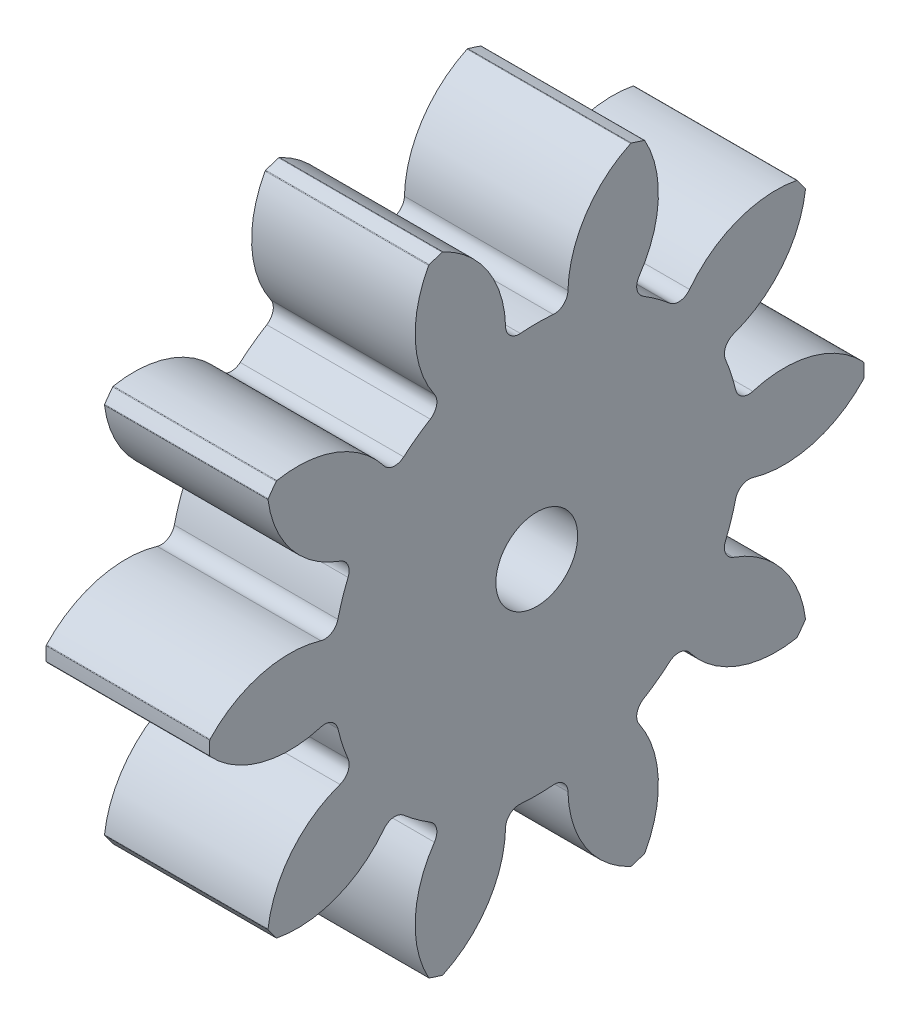
from build123d import *

# Parameters (mm, degrees)
BASPROSKE_W                = 12
BASPROSKE_H                = 24
TOOTHCUT_DEPTH             = 37
BREAKS_R                   = 0.08
ROOTFILLETS_R              = 1.001
TEETHCUTS_COUNT            = 10
TEETHCUTS_ANGLE            = 324
BREAKS_OF_TEETHCUTS_R      = 0.08
ROOTFILLETS_OF_TEETHCUTS_R = 1.001
BORSKE_R                   = 3
BORE_DEPTH                 = 50.0000508


with BuildPart() as part:
    # BasProSke → Base-Revolve (revolve)
    with BuildSketch(Plane(origin=(0, 0, 0), x_dir=(1, 0, 0), z_dir=(0, 1, 0))):
        with Locations((6, 12)):
            Rectangle(BASPROSKE_W, BASPROSKE_H)
    revolve(axis=Axis((-10, 0, 0), (1, 0, 0)))

    # TooCutSke → ToothCut (cut, through all)
    with BuildSketch(Plane(origin=(0, 0, 0), x_dir=(0, 0, -1), z_dir=(1, 0, 0))):
        with BuildLine():
            ThreePointArc((2.33803632, 14.815653451), (0, 14.999), (-2.33803632, 14.815653451))
            ThreePointArc((-2.33803632, 14.815653451), (-3.315013319, 19.654913653), (-6.946609122, 22.999227528))
            ThreePointArc((-6.946609122, 22.999227528), (0, 24.0254), (6.946609122, 22.999227528))
            ThreePointArc((6.946609122, 22.999227528), (3.315013319, 19.654913653), (2.33803632, 14.815653451))
        make_face()
    toothcut = extrude(amount=TOOTHCUT_DEPTH, mode=Mode.SUBTRACT)

    # Breaks
    breaks_edges = [part.edges().sort_by_distance(p)[0] for p in [
        (6, 22.983169708, -6.911867344),
        (6, 22.983169708, 6.911867344),
    ]]
    fillet(breaks_edges, radius=BREAKS_R)

    # RootFillets
    rootfillets_edges = [part.edges().sort_by_distance(p)[0] for p in [
        (6, 14.815653451, -2.33803632),
        (6, 14.815653451, 2.33803632),
    ]]
    fillet(rootfillets_edges, radius=ROOTFILLETS_R)

    # TeethCuts: ToothCut ×10 about axis
    teethcuts_axis = Axis((-10, 0, 0), (1, 0, 0))
    for i in range(1, TEETHCUTS_COUNT):
        add(toothcut.rotate(teethcuts_axis, i * TEETHCUTS_ANGLE / (TEETHCUTS_COUNT - 1)), mode=Mode.SUBTRACT)

    # Breaks of TeethCuts
    breaks_of_teethcuts_edges = [part.edges().sort_by_distance(p)[0] for p in [
        (6, 22.656468569, 7.917350061),
        (6, 14.531081187, 19.10098635),
        (6, 13.675766502, 19.722408843),
        (6, 0.528613547, 23.994177788),
        (6, -0.528613547, 23.994177788),
        (6, -13.675766502, 19.722408843),
        (6, -14.531081187, 19.10098635),
        (6, -22.656468569, 7.917350061),
        (6, -22.983169708, 6.911867344),
        (6, -22.983169708, -6.911867344),
        (6, -22.656468569, -7.917350061),
        (6, -14.531081187, -19.10098635),
        (6, -13.675766502, -19.722408843),
        (6, -0.528613547, -23.994177788),
        (6, 0.528613547, -23.994177788),
        (6, 13.675766502, -19.722408843),
        (6, 14.531081187, -19.10098635),
        (6, 22.656468569, -7.917350061),
    ]]
    fillet(breaks_of_teethcuts_edges, radius=BREAKS_OF_TEETHCUTS_R)

    # RootFillets of TeethCuts
    rootfillets_of_teethcuts_edges = [part.edges().sort_by_distance(p)[0] for p in [
        (6, 13.360378693, 6.816911485),
        (6, 10.611852156, 10.599933718),
        (6, 6.801893377, 13.368030801),
        (6, 2.354684021, 14.813016714),
        (6, -2.354684021, 14.813016714),
        (6, -6.801893377, 13.368030801),
        (6, -10.611852156, 10.599933718),
        (6, -13.360378693, 6.816911485),
        (6, -14.815653451, 2.33803632),
        (6, -14.815653451, -2.33803632),
        (6, -13.360378693, -6.816911485),
        (6, -10.611852156, -10.599933718),
        (6, -6.801893377, -13.368030801),
        (6, -2.354684021, -14.813016714),
        (6, 2.354684021, -14.813016714),
        (6, 6.801893377, -13.368030801),
        (6, 10.611852156, -10.599933718),
        (6, 13.360378693, -6.816911485),
    ]]
    fillet(rootfillets_of_teethcuts_edges, radius=ROOTFILLETS_OF_TEETHCUTS_R)

    # BorSke → Bore (cut, symmetric)
    with BuildSketch(Plane(origin=(0, 0, 0), x_dir=(0, 0, -1), z_dir=(1, 0, 0))):
        Circle(BORSKE_R)
    extrude(amount=BORE_DEPTH, both=True, mode=Mode.SUBTRACT)


solid = part.part
